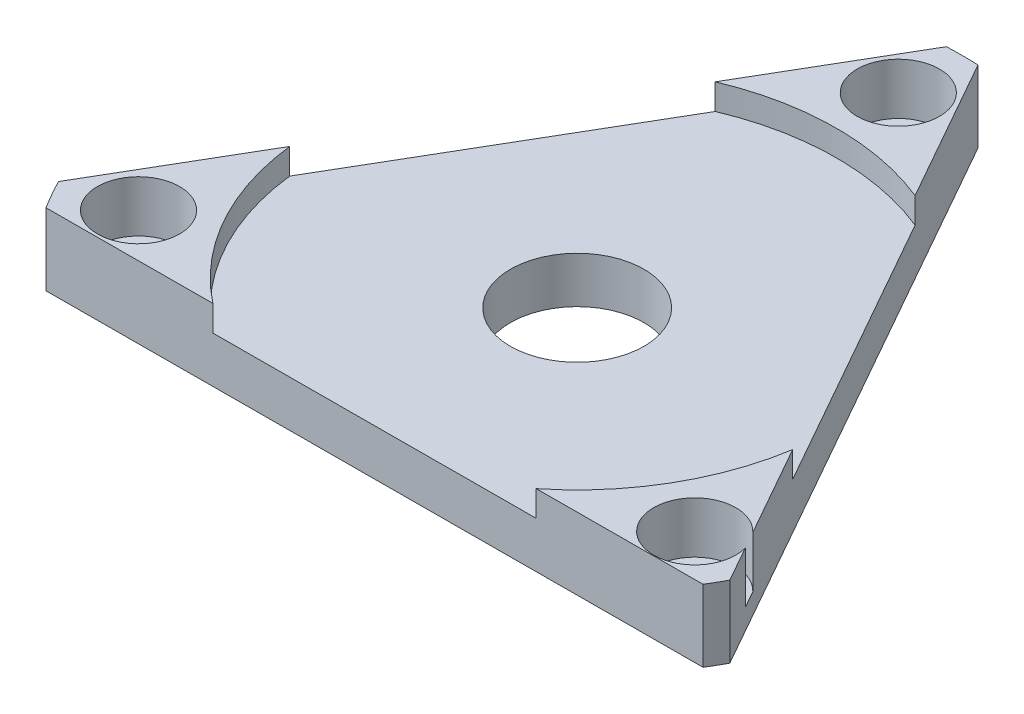
from build123d import *

# Parameters (mm, degrees)
SKETCH1_R           = 75
BOSS_EXTRUDE1_DEPTH = 14
SKETCH4_R           = 5
CUT_EXTRUDE4_DEPTH  = 107.98598039
SKETCH2_R           = 13
CUT_EXTRUDE5_DEPTH  = 107.98598039
SKETCH5_R           = 50.5
CUT_EXTRUDE6_DEPTH  = 5
SKETCH6_R           = 8
CUT_EXTRUDE7_DEPTH  = 10
CUT_EXTRUDE8_DEPTH  = 17


with BuildPart() as part:
    # Sketch1 → Boss-Extrude1 (new body)
    with BuildSketch(Plane(origin=(0, 0, 0), x_dir=(1, 0, 0), z_dir=(0, 1, 0))):
        with Locations(Location((0, 0, 0), (0, 0, 270))):
            Circle(SKETCH1_R)
    extrude(amount=BOSS_EXTRUDE1_DEPTH)

    # Sketch4 → Cut-Extrude4 (cut, through all)
    with BuildSketch(Plane(origin=(0, 14, 0), x_dir=(1, 0, 0), z_dir=(0, 1, 0))):
        with Locations(Location((0, 62.5, 0), (0, 0, 270))):
            Circle(SKETCH4_R)
        with Locations(Location((-54.126587737, -31.25, 0), (0, 0, 270))):
            Circle(SKETCH4_R)
        with Locations(Location((54.126587737, -31.25, 0), (0, 0, 270))):
            Circle(SKETCH4_R)
    extrude(amount=-CUT_EXTRUDE4_DEPTH, mode=Mode.SUBTRACT)

    # Sketch2 → Cut-Extrude5 (cut, through all)
    with BuildSketch(Plane(origin=(0, 14, 0), x_dir=(1, 0, 0), z_dir=(0, 1, 0))):
        with Locations(Location((0, 0, 0), (0, 0, 270))):
            Circle(SKETCH2_R)
    extrude(amount=-CUT_EXTRUDE5_DEPTH, mode=Mode.SUBTRACT)

    # Sketch5 → Cut-Extrude6 (cut)
    with BuildSketch(Plane(origin=(0, 14, 0), x_dir=(-1, 0, 0), z_dir=(0, 1, 0))):
        with Locations(Location((0, 0, 0), (0, 0, 90))):
            Circle(SKETCH5_R)
    extrude(amount=-CUT_EXTRUDE6_DEPTH, mode=Mode.SUBTRACT)

    # Sketch6 → Cut-Extrude7 (cut)
    with BuildSketch(Plane(origin=(0, 14, 0), x_dir=(1, 0, 0), z_dir=(0, 1, 0))):
        with Locations(Location((-54.126587737, -31.25, 0), (0, 0, 270))):
            Circle(SKETCH6_R)
        with Locations(Location((0, 62.5, 0), (0, 0, 270))):
            Circle(SKETCH6_R)
        with Locations(Location((54.126587737, -31.25, 0), (0, 0, 270))):
            Circle(SKETCH6_R)
    extrude(amount=-CUT_EXTRUDE7_DEPTH, mode=Mode.SUBTRACT)

    # Sketch7 → Cut-Extrude8 (cut)
    with BuildSketch(Plane(origin=(0, 0, 0), x_dir=(-1, 0, 0), z_dir=(0, -1, 0))):
        with BuildLine():
            ThreePointArc((75, 0), (54.10858072, 51.935166241), (3.073026868, 74.937016927))
            Line((3.073026868, 74.937016927), (66.751084117, -34.194923151))
            ThreePointArc((66.751084117, -34.194923151), (72.908611661, -17.587903389), (75, 0))
        make_face()
        with BuildLine():
            ThreePointArc((-63.846861253, -39.351979723), (-0.285812655, -74.999455406), (63.545081168, -39.837452972))
            Line((63.545081168, -39.837452972), (-63.846861253, -39.351979723))
        make_face()
        with BuildLine():
            Line((-65.762802754, -36.059031794), (-3.073026868, 74.937016927))
            ThreePointArc((-3.073026868, 74.937016927), (-65.304085384, 36.883281201), (-65.762802754, -36.059031794))
        make_face()
    extrude(amount=-CUT_EXTRUDE8_DEPTH, mode=Mode.SUBTRACT)


solid = part.part
